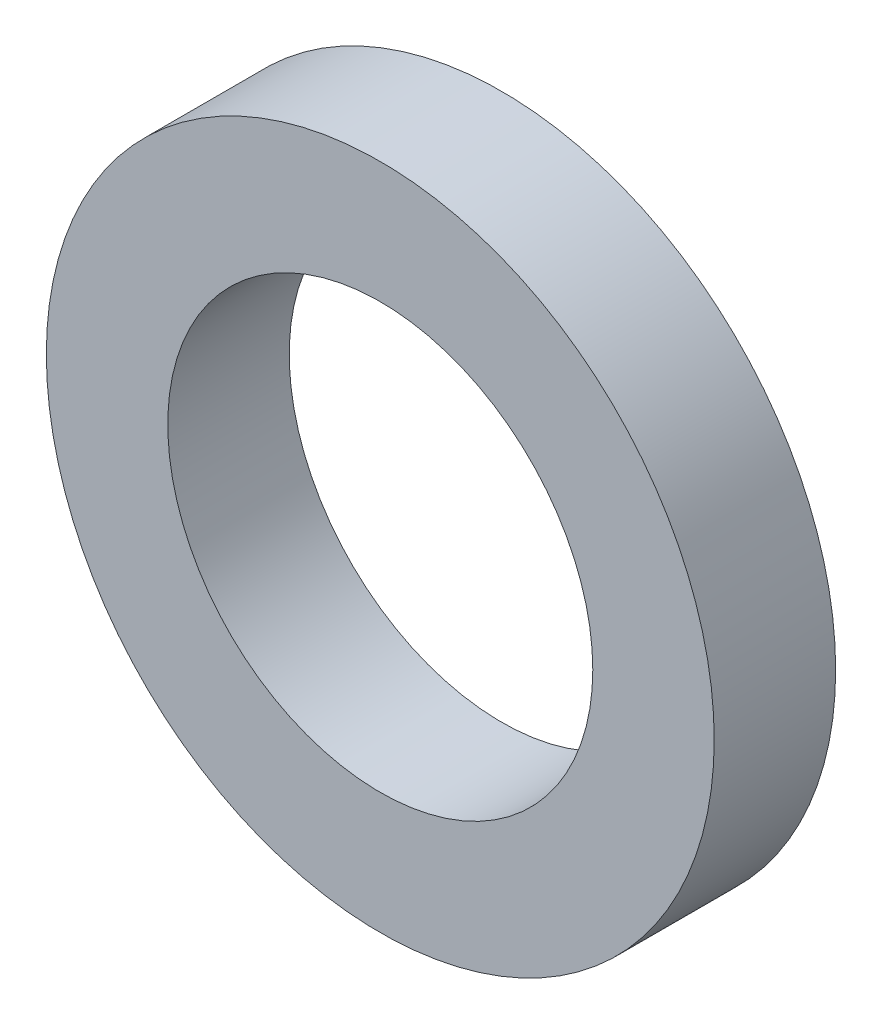
from build123d import *

# Parameters (mm, degrees)
SKETCH1_R           = 27.5
SKETCH1_R_2         = 17.5
BOSS_EXTRUDE1_DEPTH = 10


with BuildPart() as part:
    # Sketch1 → Boss-Extrude1 (new body)
    with BuildSketch(Plane.XY):
        Circle(SKETCH1_R)
        Circle(SKETCH1_R_2, mode=Mode.SUBTRACT)
    extrude(amount=BOSS_EXTRUDE1_DEPTH)


solid = part.part
